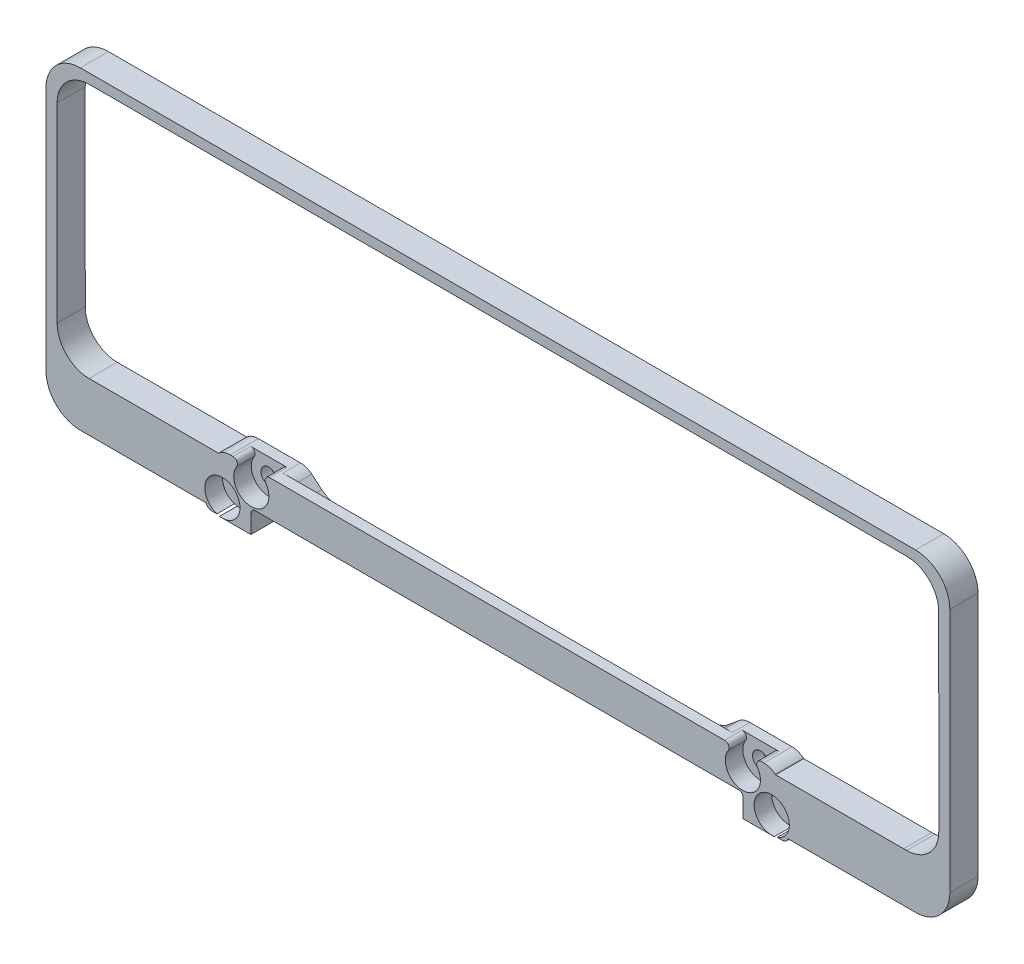
from build123d import *

# Parameters (mm, degrees)
SKETCH_1_R          = 0.9
SKETCH_1_R_2        = 0.8
EXTRUDE_1_DEPTH     = 3.2
EXTRUDE_1_2_DEPTH   = 3.2
SKETCH_2_W          = 51.115590172
SKETCH_2_H          = 4.08
EXTRUDE_2_DEPTH     = 1.2
EXTRUDE_START       = -3.2
EXTRUDE_3_DEPTH     = 3.2
SKETCH_4_R          = 2
CUT_EXTRUDE_1_DEPTH = 2
FILLET_1_R          = 0.5


with BuildPart() as part:
    # 草图1 → 凸台-拉伸1 (new body)
    with BuildSketch(Plane.XY):
        with BuildLine():
            Line((-32.44, 5.005), (-31.75, 5.005))
            ThreePointArc((-31.75, 5.005), (-31.624500996, 4.977488532), (-31.522019738, 4.9))
            Line((-31.522019738, 4.9), (-28, 4.9))
            Line((-28, 4.9), (-28, 6.996662954))
            ThreePointArc((-28, 6.996662954), (-27.853553391, 7.350216345), (-27.5, 7.496662954))
            Line((-27.5, 7.496662954), (-22.181386307, 7.496662954))
            Line((-22.181386307, 7.496662954), (-22.181386307, 9.626936565))
            ThreePointArc((-22.181386307, 9.626936565), (-22.687871835, 9.843944297), (-23.142051903, 10.155938547))
            Line((-23.142051903, 10.155938547), (-24.268653026, 11.105751817))
            ThreePointArc((-24.268653026, 11.105751817), (-24.871565433, 11.455249887), (-25.557795086, 11.576662954))
            Line((-25.557795086, 11.576662954), (-30.347104952, 11.576662954))
            ThreePointArc((-30.347104952, 11.576662954), (-31.033334605, 11.455249887), (-31.636247011, 11.105751817))
            Line((-31.636247011, 11.105751817), (-32.42914206, 10.437278989))
            ThreePointArc((-32.42914206, 10.437278989), (-32.9535992, 9.751314044), (-33.14, 8.908190127))
            Line((-33.14, 8.908190127), (-33.14, 5.705))
            ThreePointArc((-33.14, 5.705), (-32.934974747, 5.210025253), (-32.44, 5.005))
        make_face()
        with Locations(Location((-27.952450019, 9.676662954, 0), (0, 0, 270))):
            Circle(SKETCH_1_R, mode=Mode.SUBTRACT)
        with Locations(Location((-31.24, 6.905, 0), (0, 0, 270))):
            Circle(SKETCH_1_R_2, mode=Mode.SUBTRACT)
    extrude(amount=EXTRUDE_1_DEPTH)



with BuildPart() as body_2:
    # 草图1 → Extrude 1 2 (new body)
    with BuildSketch(Plane.XY):
        with BuildLine():
            Line((28, 6.996662954), (28, 4.9))
            Line((28, 4.9), (31.522019738, 4.9))
            ThreePointArc((31.522019738, 4.9), (31.624500996, 4.977488532), (31.75, 5.005))
            Line((31.75, 5.005), (32.44, 5.005))
            ThreePointArc((32.44, 5.005), (32.934974747, 5.210025253), (33.14, 5.705))
            Line((33.14, 5.705), (33.14, 8.908190127))
            ThreePointArc((33.14, 8.908190127), (32.9535992, 9.751314044), (32.42914206, 10.437278989))
            Line((32.42914206, 10.437278989), (31.636247011, 11.105751817))
            ThreePointArc((31.636247011, 11.105751817), (31.033334605, 11.455249887), (30.347104952, 11.576662954))
            Line((30.347104952, 11.576662954), (25.557795086, 11.576662954))
            ThreePointArc((25.557795086, 11.576662954), (24.871565433, 11.455249887), (24.268653026, 11.105751817))
            Line((24.268653026, 11.105751817), (23.142051903, 10.155938547))
            ThreePointArc((23.142051903, 10.155938547), (22.687871835, 9.843944297), (22.181386307, 9.626936565))
            Line((22.181386307, 9.626936565), (22.181386307, 7.496662954))
            Line((22.181386307, 7.496662954), (27.5, 7.496662954))
            ThreePointArc((27.5, 7.496662954), (27.853553391, 7.350216345), (28, 6.996662954))
        make_face()
        with Locations(Location((27.952450019, 9.676662954, 0), (0, 0, 270))):
            Circle(SKETCH_1_R, mode=Mode.SUBTRACT)
        with Locations(Location((31.24, 6.905, 0), (0, 0, 270))):
            Circle(SKETCH_1_R_2, mode=Mode.SUBTRACT)
    extrude(amount=EXTRUDE_1_2_DEPTH)


with BuildPart() as part_1:
    add(part.part)

    add(body_2.part)  # 凸台-拉伸2 merges body 2
    # 草图2 → 凸台-拉伸2 (add)
    with BuildSketch(Plane.XY.offset(3.2)):
        with Locations((0, 9.536662954)):
            Rectangle(SKETCH_2_W, SKETCH_2_H)
    extrude(amount=-EXTRUDE_2_DEPTH)

    # 草图3 → 凸台-拉伸3 (add)
    with BuildSketch(Plane.XY.offset(3.2).offset(EXTRUDE_START)):
        with BuildLine():
            Line((46.240904424, 11.074408529), (31.674834812, 11.073219269))
            Line((31.674834812, 11.073219269), (32.42914206, 10.437278989))
            ThreePointArc((32.42914206, 10.437278989), (32.9535992, 9.751314044), (33.14, 8.908190127))
            Line((33.14, 8.908190127), (33.14, 5.705))
            ThreePointArc((33.14, 5.705), (33.130629249, 5.59084554), (33.102767884, 5.479747403))
            Line((33.102767884, 5.479747403), (47.600381988, 5.480931075))
            ThreePointArc((47.600381988, 5.480931075), (50.358005162, 6.623439781), (51.500063555, 9.381249481))
            Line((51.500063555, 9.381249481), (51.497785633, 37.281249388))
            ThreePointArc((51.497785633, 37.281249388), (50.355276927, 40.038872563), (47.597467227, 41.180930956))
            Line((47.597467227, 41.180930956), (-47.402532456, 41.17317459))
            ThreePointArc((-47.402532456, 41.17317459), (-50.160155631, 40.030665884), (-51.302214024, 37.272856184))
            Line((-51.302214024, 37.272856184), (-51.299936102, 9.372856277))
            ThreePointArc((-51.299936102, 9.372856277), (-50.157427396, 6.615233102), (-47.399617696, 5.473174709))
            Line((-47.399617696, 5.473174709), (-33.10090616, 5.474342141))
            ThreePointArc((-33.10090616, 5.474342141), (-33.130157341, 5.58802631), (-33.14, 5.705))
            Line((-33.14, 5.705), (-33.14, 8.908190127))
            ThreePointArc((-33.14, 8.908190127), (-32.9535992, 9.751314044), (-32.42914206, 10.437278989))
            Line((-32.42914206, 10.437278989), (-31.673318835, 11.074497357))
            Line((-31.673318835, 11.074497357), (-46.40016763, 11.073294969))
            ThreePointArc((-46.40016763, 11.073294969), (-48.972219468, 12.138427704), (-50.037772184, 14.71030558))
            Line((-50.037772184, 14.71030558), (-50.039543904, 36.410348688))
            ThreePointArc((-50.039543904, 36.410348688), (-48.974411169, 38.982400526), (-46.402533293, 40.047953242))
            Line((-46.402533293, 40.047953242), (46.597651817, 40.055546331))
            ThreePointArc((46.597651817, 40.055546331), (49.169703655, 38.990413596), (50.235256371, 36.41853572))
            Line((50.235256371, 36.41853572), (50.237028092, 14.718492612))
            ThreePointArc((50.237028092, 14.718492612), (49.171895357, 12.146440774), (46.600017481, 11.080888058))
            ThreePointArc((46.600017481, 11.080888058), (46.420490045, 11.076035874), (46.240904424, 11.074408529))
        make_face()
    extrude(amount=EXTRUDE_3_DEPTH)

    # 草图4 → 切除-拉伸1 (cut)
    with BuildSketch(Plane.XY.offset(3.2)):
        with Locations((-27.952450019, 9.676662954)):
            Circle(SKETCH_4_R)
        with Locations((27.952450019, 9.676662954)):
            Circle(SKETCH_4_R)
        with Locations((-31.24, 6.905)):
            Circle(SKETCH_4_R)
        with Locations((31.24, 6.905)):
            Circle(SKETCH_4_R)
    extrude(amount=-CUT_EXTRUDE_1_DEPTH, mode=Mode.SUBTRACT)

    # 圆角1
    fillet_1_edges = [part_1.edges().sort_by_distance(p)[0] for p in [
        (-27.327950219, 11.576662954, 2.2),
        (-28.576949819, 11.576662954, 2.2),
        (28.576949819, 11.576662954, 2.2),
        (27.327950219, 11.576662954, 2.2),
    ]]
    fillet(fillet_1_edges, radius=FILLET_1_R)


solid = part_1.part
